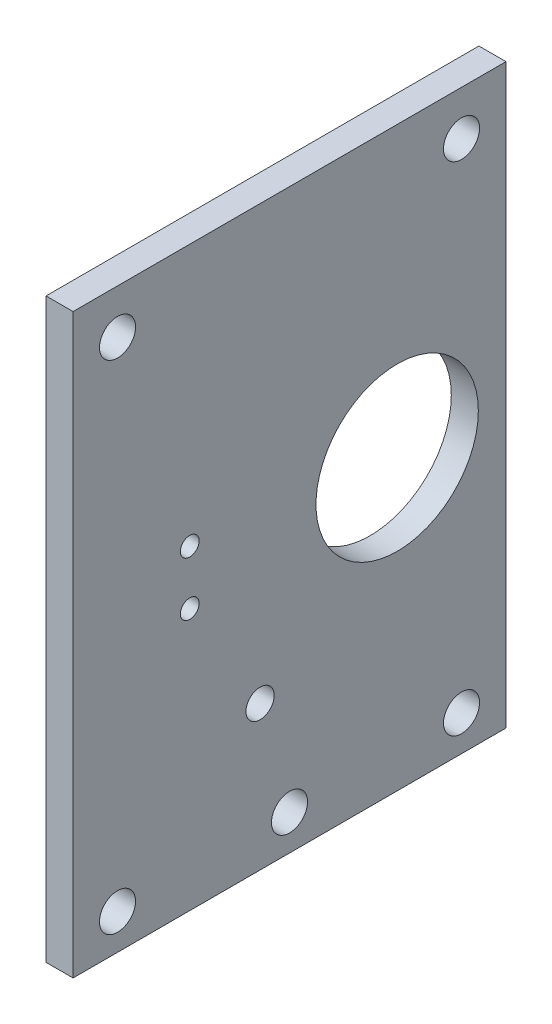
from build123d import *

# Parameters (mm, degrees)
SKETCH2_W            = 76.2
SKETCH2_H            = 101.6
BOSS_EXTRUDE1_DEPTH  = 4.7625
SKETCH3_R            = 3.175
CUT_EXTRUDE1_DEPTH   = 6.35
SKETCH3_4_R          = 3.175
SKETCH3_4_R_2        = 14.2875
SKETCH3_4_R_3        = 2.4892
CUT_EXTRUDE2_DEPTH   = 6.35
M6_CLEARANCE_HOLE1_D = 3.3


with BuildPart() as part:
    # Sketch2 → Boss-Extrude1 (new body)
    with BuildSketch(Plane(origin=(0, 0, 0), x_dir=(0, 0, -1), z_dir=(1, 0, 0))):
        Rectangle(SKETCH2_W, SKETCH2_H)
    extrude(amount=BOSS_EXTRUDE1_DEPTH)

    # Sketch3 → Cut-Extrude1 (cut)
    with BuildSketch(Plane(origin=(4.7625, 0, 0), x_dir=(0, 0, -1), z_dir=(1, 0, 0))):
        with Locations((30.2768, 42.9768)):
            Circle(SKETCH3_R)
    extrude(amount=-CUT_EXTRUDE1_DEPTH, mode=Mode.SUBTRACT)

    # Sketch3<4> → Cut-Extrude2 (cut)
    with BuildSketch(Plane(origin=(4.7625, 0, 0), x_dir=(0, 0, -1), z_dir=(1, 0, 0))):
        with Locations((30.2768, -44.5643)):
            Circle(SKETCH3_4_R)
        with Locations((30.2768, 42.9768)):
            Circle(SKETCH3_4_R)
        with Locations((-30.2768, 42.9768)):
            Circle(SKETCH3_4_R)
        with Locations((-30.2768, -44.5643)):
            Circle(SKETCH3_4_R)
        with Locations((18.9484, 0)):
            Circle(SKETCH3_4_R_2)
        with Locations((-5.1816, -25.4)):
            Circle(SKETCH3_4_R_3)
        with Locations((0, -44.5643)):
            Circle(SKETCH3_4_R)
    extrude(amount=-CUT_EXTRUDE2_DEPTH, mode=Mode.SUBTRACT)

    # M6 Clearance Hole1 (through all)
    with Locations(Plane(origin=(4.7625, 0, 0), x_dir=(0, 0, -1), z_dir=(1, 0, 0))):
        with Locations((-17.5641, -4.7625), (-17.5641, 4.7625)):
            Hole(M6_CLEARANCE_HOLE1_D / 2)


solid = part.part
